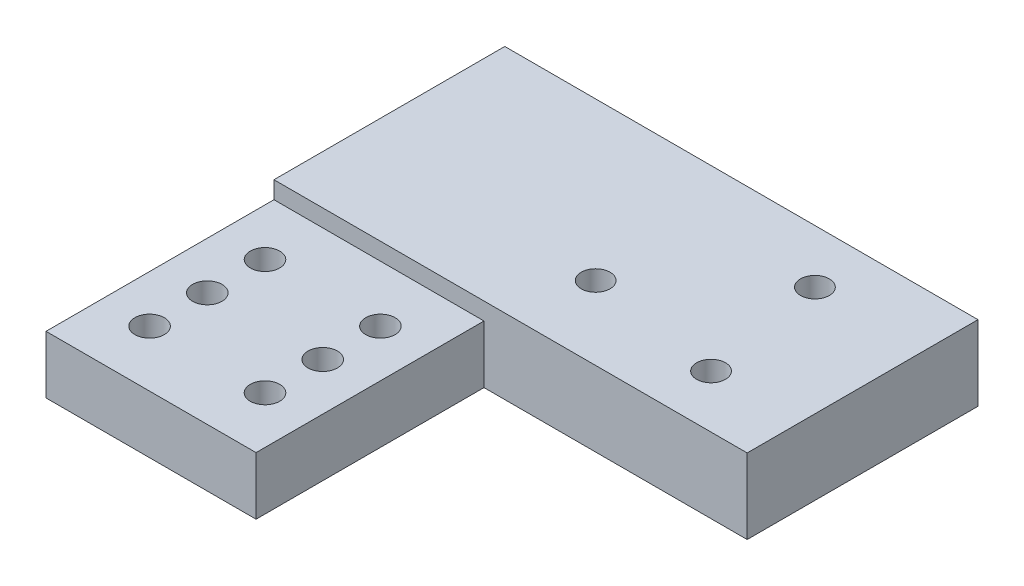
from build123d import *

# Parameters (mm, degrees)
SKETCH1_W                = 36.4
SKETCH1_H                = 39.5
SKETCH1_R                = 2.55
BOSS_EXTRUDE1_DEPTH      = 10
BOSS_EXTRUDE2_DEPTH      = 3
BOSS_EXTRUDE2_DEPTH_BACK = 10
SKETCH2_W                = 82
SKETCH2_H                = 40
F_5_0MM_DOWEL_HOLE1_D    = 5


with BuildPart() as part:
    # Sketch1 → Boss-Extrude1 (new body)
    with BuildSketch(Plane(origin=(0, 0, 0), x_dir=(1, 0, 0), z_dir=(0, 1, 0))):
        with Locations((18.2, 19.75)):
            Rectangle(SKETCH1_W, SKETCH1_H)
        with Locations(Location((8.2, 29.75, 0), (0, 0, 270))):
            Circle(SKETCH1_R, mode=Mode.SUBTRACT)
        with Locations(Location((28.2, 29.75, 0), (0, 0, 270))):
            Circle(SKETCH1_R, mode=Mode.SUBTRACT)
        with Locations(Location((28.2, 19.75, 0), (0, 0, 270))):
            Circle(SKETCH1_R, mode=Mode.SUBTRACT)
        with Locations(Location((28.2, 9.75, 0), (0, 0, 270))):
            Circle(SKETCH1_R, mode=Mode.SUBTRACT)
        with Locations(Location((8.2, 19.75, 0), (0, 0, 270))):
            Circle(SKETCH1_R, mode=Mode.SUBTRACT)
        with Locations(Location((8.2, 9.75, 0), (0, 0, 270))):
            Circle(SKETCH1_R, mode=Mode.SUBTRACT)
    extrude(amount=BOSS_EXTRUDE1_DEPTH)

    # Sketch2 → Boss-Extrude2 (add, two sides: drawn at the far end of the back side and taken through both)
    with BuildSketch(Plane(origin=(0, 10, 0), x_dir=(1, 0, 0), z_dir=(0, 1, 0)).offset(-BOSS_EXTRUDE2_DEPTH_BACK)):
        with Locations((41, 59.5)):
            Rectangle(SKETCH2_W, SKETCH2_H)
    extrude(amount=BOSS_EXTRUDE2_DEPTH + BOSS_EXTRUDE2_DEPTH_BACK)

    # Ø5.0mm Dowel Hole1 (through all)
    with Locations(Plane(origin=(42.996100309, 13, -52.245667008), x_dir=(0, 0, 1), z_dir=(0, 1, 0))):
        with Locations((0, 0), (-18, 20), (3.585786438, 23.585786437)):
            Hole(F_5_0MM_DOWEL_HOLE1_D / 2)


solid = part.part
